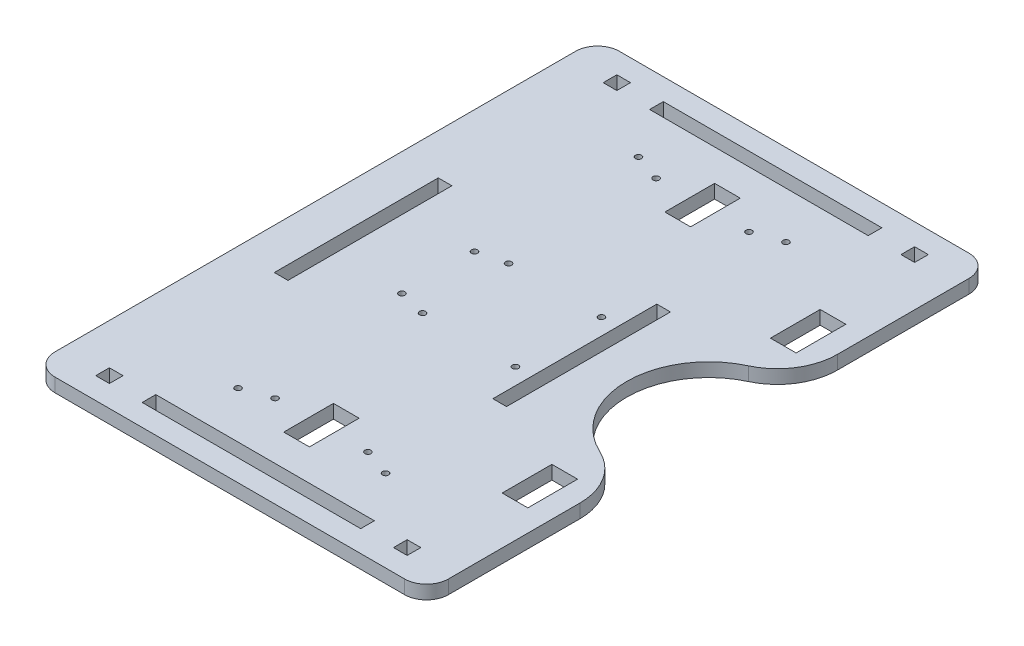
from build123d import *

# Parameters (mm, degrees)
SKETCH3_R           = 1.4224
SKETCH3_W           = 6.35
SKETCH3_H           = 6.35
SKETCH3_W_2         = 11.938
SKETCH3_H_2         = 23.114
SKETCH3_W_3         = 101.6
SKETCH3_H_3         = 76.2
BOSS_EXTRUDE1_DEPTH = 6.35
FILLET1_R           = 10.16
FILLET2_R           = 27.94


with BuildPart() as part:
    # Sketch3 → Boss-Extrude1 (new body)
    with BuildSketch(Plane(origin=(0, 0, 0), x_dir=(1, 0, 0), z_dir=(0, 1, 0))):
        with BuildLine():
            Line((182.88, 0), (0, 0))
            Line((0, 0), (0, 262.339276313))
            Line((0, 262.339276313), (182.88, 262.339276313))
            Line((182.88, 262.339276313), (182.88, 169.269638157))
            ThreePointArc((182.88, 169.269638157), (144.78, 131.169638157), (182.88, 93.069638157))
            Line((182.88, 93.069638157), (182.88, 0))
        make_face()
        with Locations(Location((57.15, 38.1, 0), (0, 0, 270))):
            Circle(SKETCH3_R, mode=Mode.SUBTRACT)
        with Locations(Location((57.15, 114.3, 0), (0, 0, 270))):
            Circle(SKETCH3_R, mode=Mode.SUBTRACT)
        with Locations(Location((125.73, 38.1, 0), (0, 0, 90))):
            Circle(SKETCH3_R, mode=Mode.SUBTRACT)
        with Locations(Location((69.85, 151.157668748, 0), (0, 0, 270))):
            Circle(SKETCH3_R, mode=Mode.SUBTRACT)
        with Locations(Location((69.85, 219.737668748, 0), (0, 0, 270))):
            Circle(SKETCH3_R, mode=Mode.SUBTRACT)
        with Locations(Location((113.03, 151.157668748, 0), (0, 0, 90))):
            Circle(SKETCH3_R, mode=Mode.SUBTRACT)
        with Locations(Location((113.03, 219.737668748, 0), (0, 0, 90))):
            Circle(SKETCH3_R, mode=Mode.SUBTRACT)
        with Locations(Location((113.03, 42.601607565, 0), (0, 0, 270))):
            Circle(SKETCH3_R, mode=Mode.SUBTRACT)
        with Locations(Location((113.03, 111.181607565, 0), (0, 0, 270))):
            Circle(SKETCH3_R, mode=Mode.SUBTRACT)
        with Locations(Location((69.85, 111.181607565, 0), (0, 0, 90))):
            Circle(SKETCH3_R, mode=Mode.SUBTRACT)
        with Locations(Location((69.85, 42.601607565, 0), (0, 0, 90))):
            Circle(SKETCH3_R, mode=Mode.SUBTRACT)
        with Locations(Location((125.73, 224.239276313, 0), (0, 0, 270))):
            Circle(SKETCH3_R, mode=Mode.SUBTRACT)
        with Locations(Location((57.15, 224.239276313, 0), (0, 0, 90))):
            Circle(SKETCH3_R, mode=Mode.SUBTRACT)
        with Locations(Location((57.15, 148.039276313, 0), (0, 0, 90))):
            Circle(SKETCH3_R, mode=Mode.SUBTRACT)
        with Locations((22.225, 13.212735966)):
            Rectangle(SKETCH3_W, SKETCH3_H, mode=Mode.SUBTRACT)
        with Locations((160.655, 13.212735966)):
            Rectangle(SKETCH3_W, SKETCH3_H, mode=Mode.SUBTRACT)
        with Locations((160.655, 249.126540348)):
            Rectangle(SKETCH3_W, SKETCH3_H, mode=Mode.SUBTRACT)
        with Locations((22.225, 249.126540348)):
            Rectangle(SKETCH3_W, SKETCH3_H, mode=Mode.SUBTRACT)
        with Locations((166.751, 193.526638157)):
            Rectangle(SKETCH3_W_2, SKETCH3_H_2, mode=Mode.SUBTRACT)
        with Locations((166.751, 68.812638157)):
            Rectangle(SKETCH3_W_2, SKETCH3_H_2, mode=Mode.SUBTRACT)
        with Locations((91.44, 249.126540348)):
            Rectangle(SKETCH3_W_3, SKETCH3_H, mode=Mode.SUBTRACT)
        with Locations((91.44, 13.212735966)):
            Rectangle(SKETCH3_W_3, SKETCH3_H, mode=Mode.SUBTRACT)
        with Locations((123.825, 131.169638157)):
            Rectangle(SKETCH3_W, SKETCH3_H_3, mode=Mode.SUBTRACT)
        with Locations((22.225, 131.169638157)):
            Rectangle(SKETCH3_W, SKETCH3_H_3, mode=Mode.SUBTRACT)
        with Locations((91.44, 42.57414812)):
            Rectangle(SKETCH3_W_2, SKETCH3_H_2, mode=Mode.SUBTRACT)
        with Locations((91.44, 219.765128193)):
            Rectangle(SKETCH3_W_2, SKETCH3_H_2, mode=Mode.SUBTRACT)
    extrude(amount=BOSS_EXTRUDE1_DEPTH)

    # Fillet1
    fillet1_edges = [part.edges().sort_by_distance(p)[0] for p in [
        (0, 3.175, -262.339276313),
        (182.88, 3.175, -262.339276313),
        (182.88, 3.175, 0),
        (0, 3.175, 0),
    ]]
    fillet(fillet1_edges, radius=FILLET1_R)

    # Fillet2
    fillet2_edges = [part.edges().sort_by_distance(p)[0] for p in [
        (182.88, 3.175, -169.269638157),
        (182.88, 3.175, -93.069638157),
    ]]
    fillet(fillet2_edges, radius=FILLET2_R)


solid = part.part
